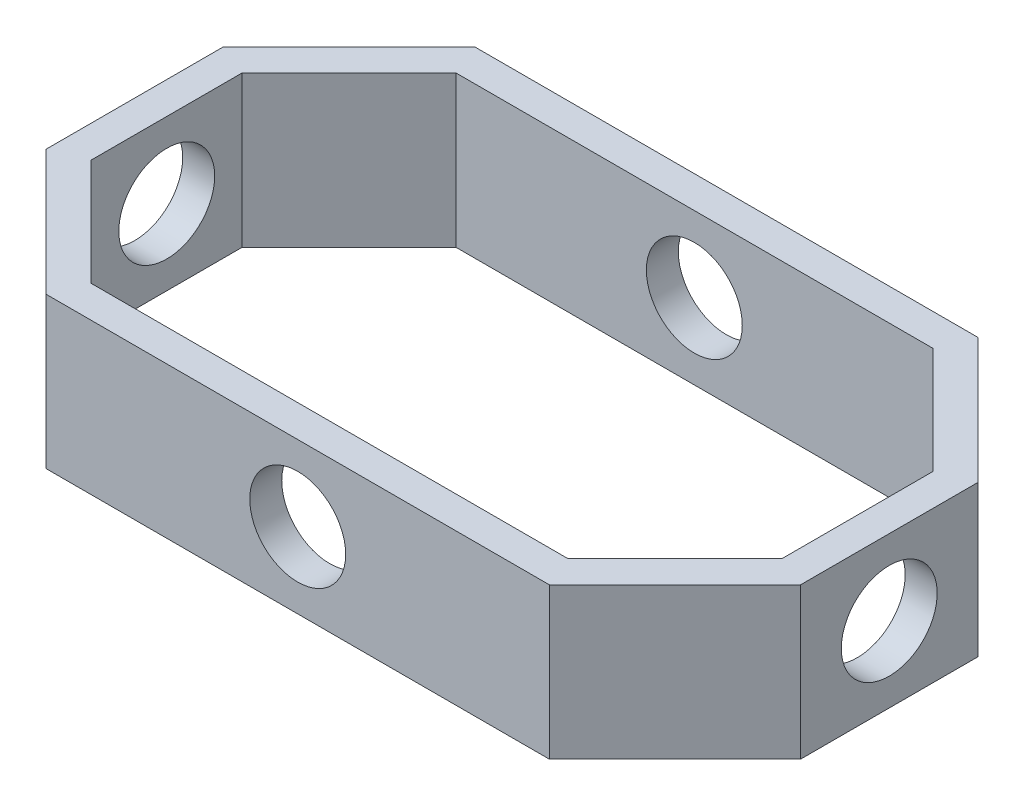
from build123d import *

# Parameters (mm, degrees)
BOSS_EXTRUDE2_DEPTH = 15
CUT_EXTRUDE2_REACH  = 60.655
SKETCH4_R           = 4.7625
CIRPATTERN2_COUNT   = 4


with BuildPart() as part:
    # Sketch3 → Boss-Extrude2 (new body)
    with BuildSketch(Plane(origin=(0, 0, 0), x_dir=(1, 0, 0), z_dir=(0, 1, 0))):
        Polygon((-25, -21.281601718), (25, -21.281601718), (37.466473657, -8.815128061), (37.466473657, 8.815128061), (25, 21.281601718), (-25, 21.281601718), (-37.466473657, 8.815128061), (-37.466473657, -8.815128061), align=None)
        Polygon((-34.291473657, -7.5), (-23.684871939, -18.106601718), (23.684871939, -18.106601718), (34.291473657, -7.5), (34.291473657, 7.5), (23.684871939, 18.106601718), (-23.684871939, 18.106601718), (-34.291473657, 7.5), align=None, mode=Mode.SUBTRACT)
    extrude(amount=BOSS_EXTRUDE2_DEPTH)

    # Sketch4 → Cut-Extrude2 (cut, up to next)
    with BuildSketch(Plane.XY.offset(21.281601718), mode=Mode.PRIVATE) as cut_extrude2_sk1:
        with Locations((0, 7.5)):
            Circle(SKETCH4_R)
    cut_extrude2_tool1 = extrude(cut_extrude2_sk1.sketch, amount=-CUT_EXTRUDE2_REACH, mode=Mode.PRIVATE) & part.part
    cut_extrude2 = cut_extrude2_tool1.solids().sort_by_distance((0, 7.5, 21.281602))[0]
    add(cut_extrude2, mode=Mode.SUBTRACT)

    # CirPattern2: Cut-Extrude2; each copy of Cut-Extrude2 runs up to whatever stops it at its own place
    cirpattern2_before = part.part  # the part as the pattern finds it: every copy runs up to it
    cirpattern2_cut_extrude2_long = extrude(cut_extrude2_sk1.sketch, amount=-CUT_EXTRUDE2_REACH, mode=Mode.PRIVATE)
    cirpattern2_cut_extrude2_tool1 = cirpattern2_cut_extrude2_long.rotate(Axis((0, 0, 0), (0, 1, 0)), 1 * 360 / CIRPATTERN2_COUNT) & cirpattern2_before
    add(cirpattern2_cut_extrude2_tool1.solids().sort_by_distance((21.281602, 7.5, 0))[0], mode=Mode.SUBTRACT)
    cirpattern2_cut_extrude2_tool2 = cirpattern2_cut_extrude2_long.rotate(Axis((0, 0, 0), (0, 1, 0)), 2 * 360 / CIRPATTERN2_COUNT) & cirpattern2_before
    add(cirpattern2_cut_extrude2_tool2.solids().sort_by_distance((0, 7.5, -21.281602))[0], mode=Mode.SUBTRACT)
    cirpattern2_cut_extrude2_tool3 = cirpattern2_cut_extrude2_long.rotate(Axis((0, 0, 0), (0, 1, 0)), 3 * 360 / CIRPATTERN2_COUNT) & cirpattern2_before
    add(cirpattern2_cut_extrude2_tool3.solids().sort_by_distance((-21.281602, 7.5, 0))[0], mode=Mode.SUBTRACT)


solid = part.part
